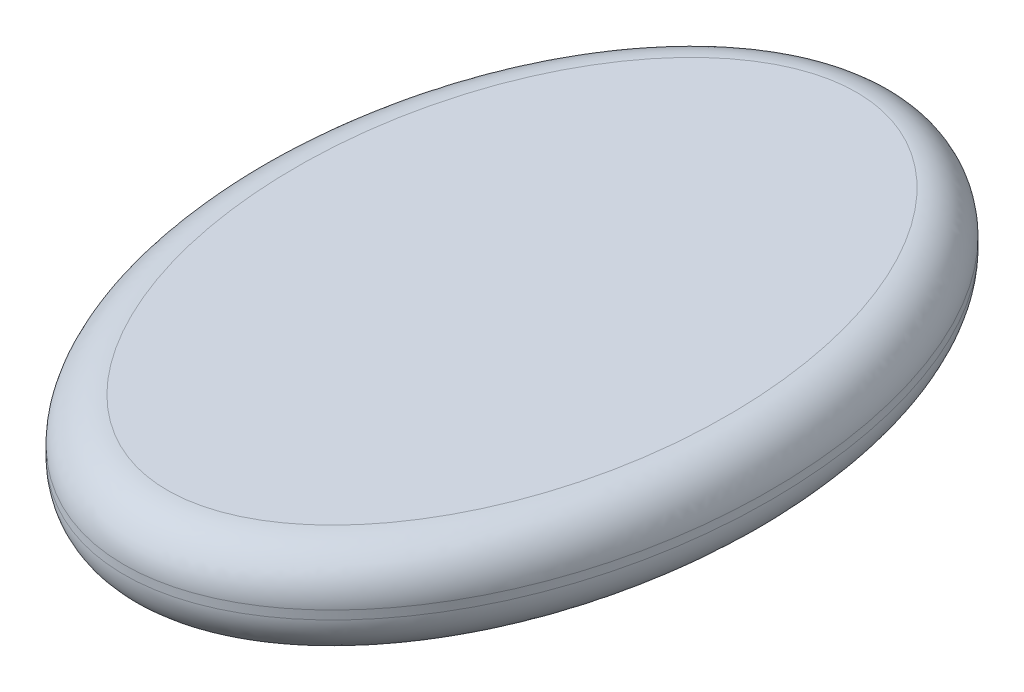
from build123d import *

# Parameters (mm, degrees)
SKETCH1_RX          = 90
SKETCH1_RY          = 60
BOSS_EXTRUDE3_DEPTH = 11
FILLET1_R           = 10
SHELL4_T            = 2.5


with BuildPart() as part:
    # Sketch1 → Boss-Extrude3 (new, symmetric)
    with BuildSketch(Plane(origin=(0, 0, 0), x_dir=(1, 0, 0), z_dir=(0, 1, 0))):
        with Locations(Location((0, 0), (0, 0, 90))):
            Ellipse(SKETCH1_RX, SKETCH1_RY)
    extrude(amount=BOSS_EXTRUDE3_DEPTH, both=True)

    # Fillet1
    fillet1_edges = [part.edges().sort_by_distance(p)[0] for p in [
        (0.063886799, -11, 89.999948981),
        (0.063886799, 11, 89.999948981),
    ]]
    fillet(fillet1_edges, radius=FILLET1_R)

    # Shell4 (no face opened: a closed hollow body)
    add(offset(amount=-SHELL4_T, mode=Mode.PRIVATE), mode=Mode.SUBTRACT)


solid = part.part
